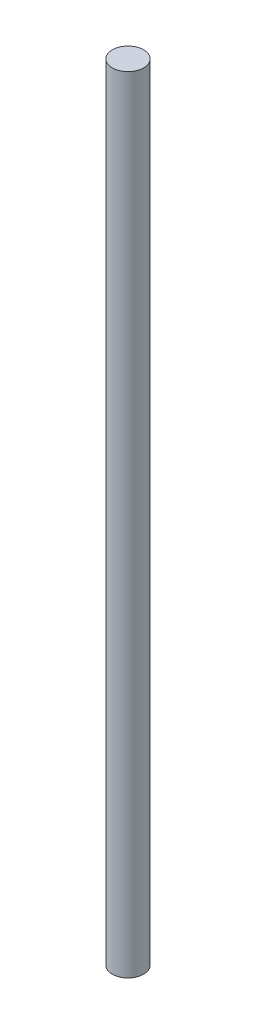
from build123d import *

# Parameters (mm, degrees)
SKETCH_1_R      = 3
EXTRUDE_1_DEPTH = 75


with BuildPart() as part:
    # 草图1 → 凸台-拉伸1 (new, symmetric)
    with BuildSketch(Plane(origin=(0, 0, 0), x_dir=(1, 0, 0), z_dir=(0, 1, 0))):
        with Locations(Location((0, 0, 0), (0, 0, 270))):
            Circle(SKETCH_1_R)
    extrude(amount=EXTRUDE_1_DEPTH, both=True)


solid = part.part
